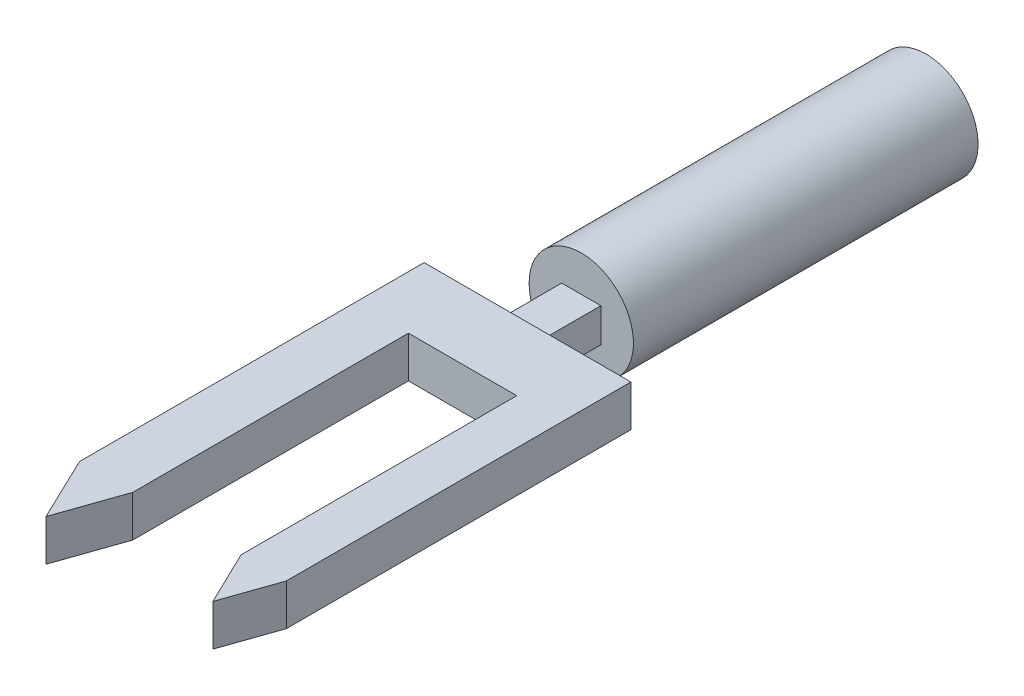
from build123d import *

# Parameters (mm, degrees)
BOSS_EXTRUDE1_DEPTH = 3
SKETCH2_W           = 2.84238377
SKETCH2_H           = 2.456975153
BOSS_EXTRUDE2_DEPTH = 4
SKETCH3_R           = 3.785280903
BOSS_EXTRUDE3_DEPTH = 25


with BuildPart() as part:
    # Sketch1 → Boss-Extrude1 (new body)
    with BuildSketch(Plane(origin=(0, 0, 0), x_dir=(1, 0, 0), z_dir=(0, 1, 0))):
        Polygon((-7.401746725, 0), (7.598253275, 0), (7.598253275, -25), (6.222707424, -28.945414847), (4.317186999, -25), (4.317186999, -5), (-3.537117904, -5), (-3.537117904, -25), (-5.163870247, -29.665938865), (-7.401746725, -25), align=None)
    extrude(amount=BOSS_EXTRUDE1_DEPTH)

    # Sketch2 → Boss-Extrude2 (add)
    with BuildSketch(Plane(origin=(0, 0, 0), x_dir=(-1, 0, 0), z_dir=(0, 0, -1))):
        with Locations((0, 1.475753534)):
            Rectangle(SKETCH2_W, SKETCH2_H)
    extrude(amount=BOSS_EXTRUDE2_DEPTH)

    # Sketch3 → Boss-Extrude3 (add)
    with BuildSketch(Plane(origin=(0, 0, -4), x_dir=(-1, 0, 0), z_dir=(0, 0, -1))):
        with Locations((0, 1.524246465)):
            Circle(SKETCH3_R)
    extrude(amount=BOSS_EXTRUDE3_DEPTH)


solid = part.part
